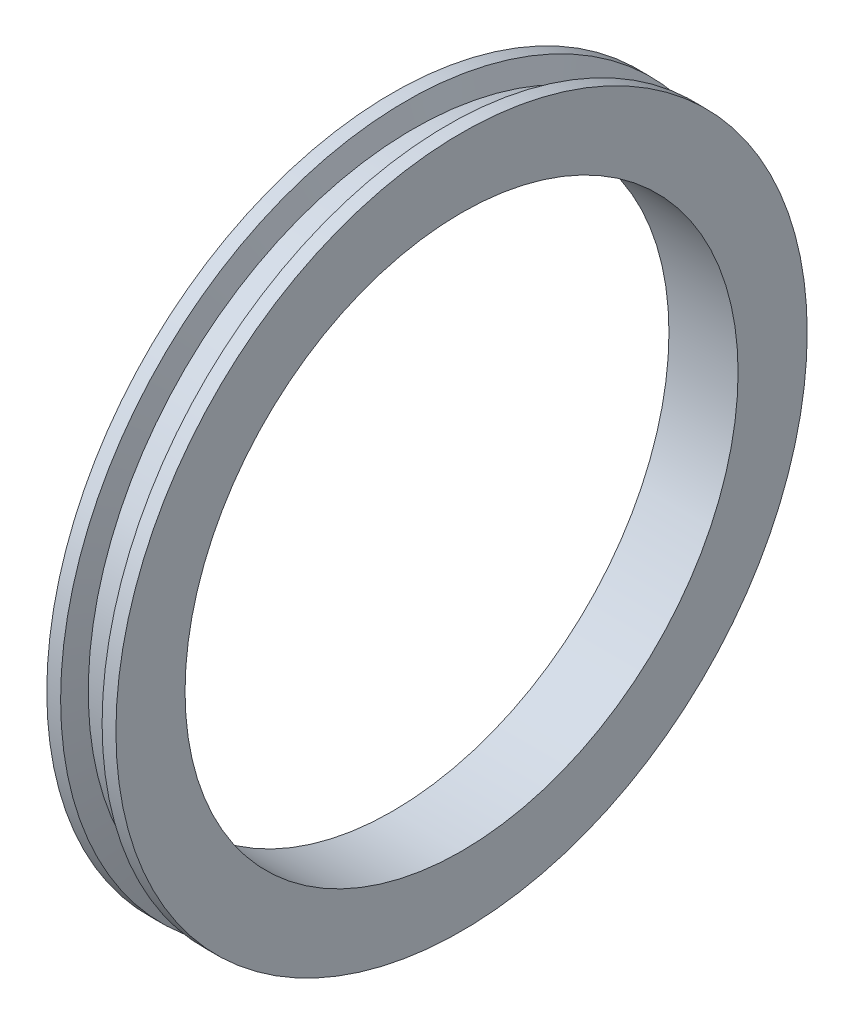
from build123d import *

# Parameters (mm, degrees)
SKETCH2_R          = 40
CUT_EXTRUDE1_DEPTH = 10


with BuildPart() as part:
    # Sketch1 → Revolve1 (revolve)
    with BuildSketch(Plane.XY, mode=Mode.PRIVATE) as revolve1_sk:
        Polygon((0, 0), (0, 50), (2, 50), (3, 47), (7, 47), (8, 50), (10, 50), (10, 0), align=None)
    revolve(revolve1_sk.sketch.rotate(Axis((10, 0, 0), (-1, 0, 0)), 90), axis=Axis((10, 0, 0), (-1, 0, 0)))

    # Sketch2 → Cut-Extrude1 (cut)
    with BuildSketch(Plane(origin=(10, 0, 0), x_dir=(0, 0, -1), z_dir=(1, 0, 0))):
        Circle(SKETCH2_R)
    extrude(amount=-CUT_EXTRUDE1_DEPTH, mode=Mode.SUBTRACT)


solid = part.part
